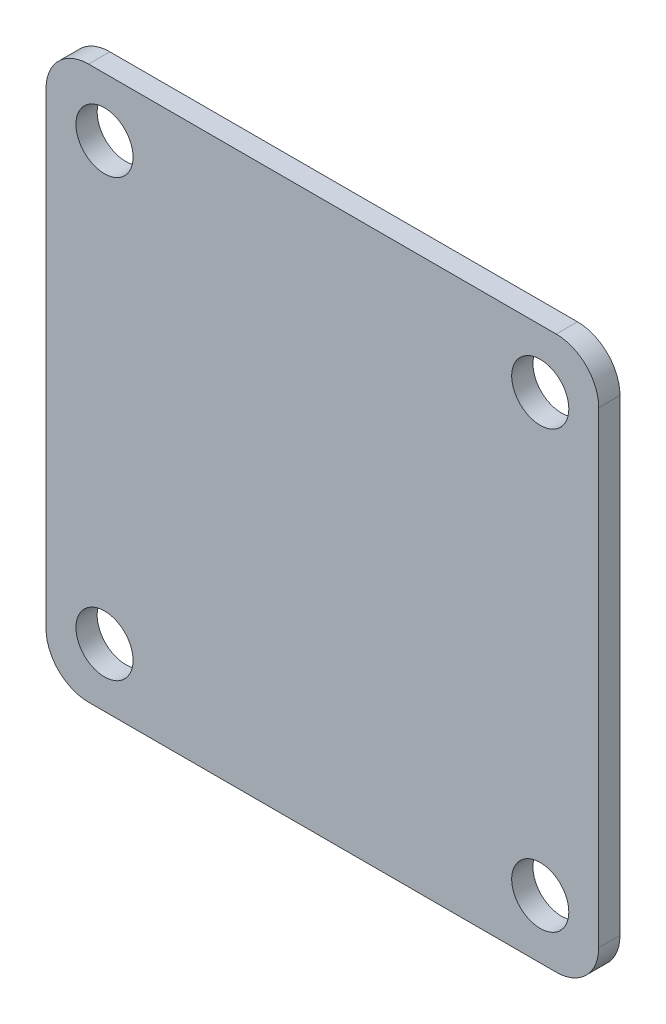
from build123d import *

# Parameters (mm, degrees)
SKETCH1_W      = 165.1
SKETCH1_H      = 165.1
SKETCH1_R      = 8.5328125
EXTRUDE1_DEPTH = 6.35
FILLET1_R      = 12.7


with BuildPart() as part:
    # Sketch1 → Extrude1 (new body)
    with BuildSketch(Plane.XY):
        Rectangle(SKETCH1_W, SKETCH1_H)
        with Locations((-65.0875, -65.0875)):
            Circle(SKETCH1_R, mode=Mode.SUBTRACT)
        with Locations((-65.0875, 65.0875)):
            Circle(SKETCH1_R, mode=Mode.SUBTRACT)
        with Locations((65.0875, 65.0875)):
            Circle(SKETCH1_R, mode=Mode.SUBTRACT)
        with Locations((65.0875, -65.0875)):
            Circle(SKETCH1_R, mode=Mode.SUBTRACT)
    extrude(amount=EXTRUDE1_DEPTH)

    # Fillet1
    fillet1_edges = [part.edges().sort_by_distance(p)[0] for p in [
        (-82.55, 82.55, 3.175),
        (82.55, 82.55, 3.175),
        (82.55, -82.55, 3.175),
        (-82.55, -82.55, 3.175),
    ]]
    fillet(fillet1_edges, radius=FILLET1_R)


solid = part.part
